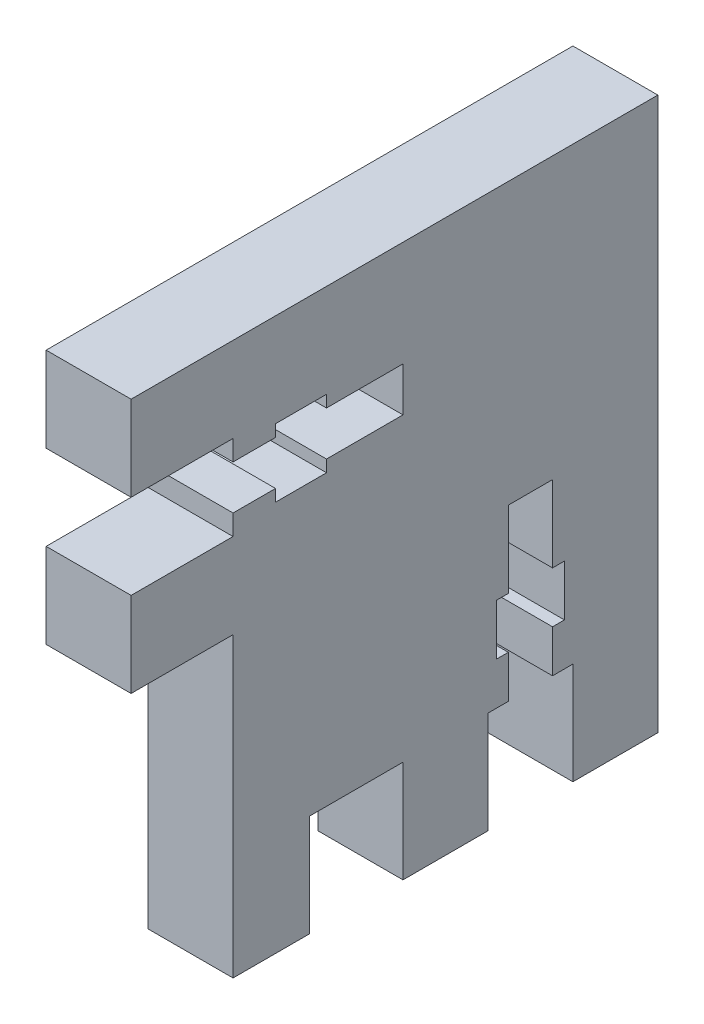
from build123d import *

# Parameters (mm, degrees)
SKETCH1_W           = 62
SKETCH1_H           = 65
BOSS_EXTRUDE1_DEPTH = 10
SKETCH2_W           = 12
SKETCH2_H           = 35
SKETCH2_W_2         = 11
SKETCH2_H_2         = 12
CUT_EXTRUDE2_DEPTH  = 47.013584951


with BuildPart() as part:
    # Sketch1 → Boss-Extrude1 (new body)
    with BuildSketch(Plane(origin=(0, 0, 0), x_dir=(0, 0, -1), z_dir=(1, 0, 0))):
        Rectangle(SKETCH1_W, SKETCH1_H)
    extrude(amount=BOSS_EXTRUDE1_DEPTH)

    # Sketch2 → Cut-Extrude2 (cut, through all)
    with BuildSketch(Plane(origin=(10, 0, 0), x_dir=(0, 0, -1), z_dir=(1, 0, 0))):
        with Locations((-25, -15)):
            Rectangle(SKETCH2_W, SKETCH2_H)
        Polygon((18.6, -20.5), (21, -20.5), (21, -32.5), (11, -32.5), (11, -20.5), (13.4, -20.5), (13.4, -15.5), (12, -15.5), (12, -9.5), (13.4, -9.5), (13.4, -0.5), (18.6, -0.5), (18.6, -9.5), (20, -9.5), (20, -15.5), (18.6, -15.5), align=None)
        Polygon((-19, 12.5), (-31, 12.5), (-31, 22.5), (-19, 22.5), (-19, 20.1), (-14, 20.1), (-14, 21.5), (-8, 21.5), (-8, 20.1), (1, 20.1), (1, 14.9), (-8, 14.9), (-8, 13.5), (-14, 13.5), (-14, 14.9), (-19, 14.9), align=None)
        with Locations((-4.5, -26.5)):
            Rectangle(SKETCH2_W_2, SKETCH2_H_2)
    extrude(amount=-CUT_EXTRUDE2_DEPTH, mode=Mode.SUBTRACT)


solid = part.part
